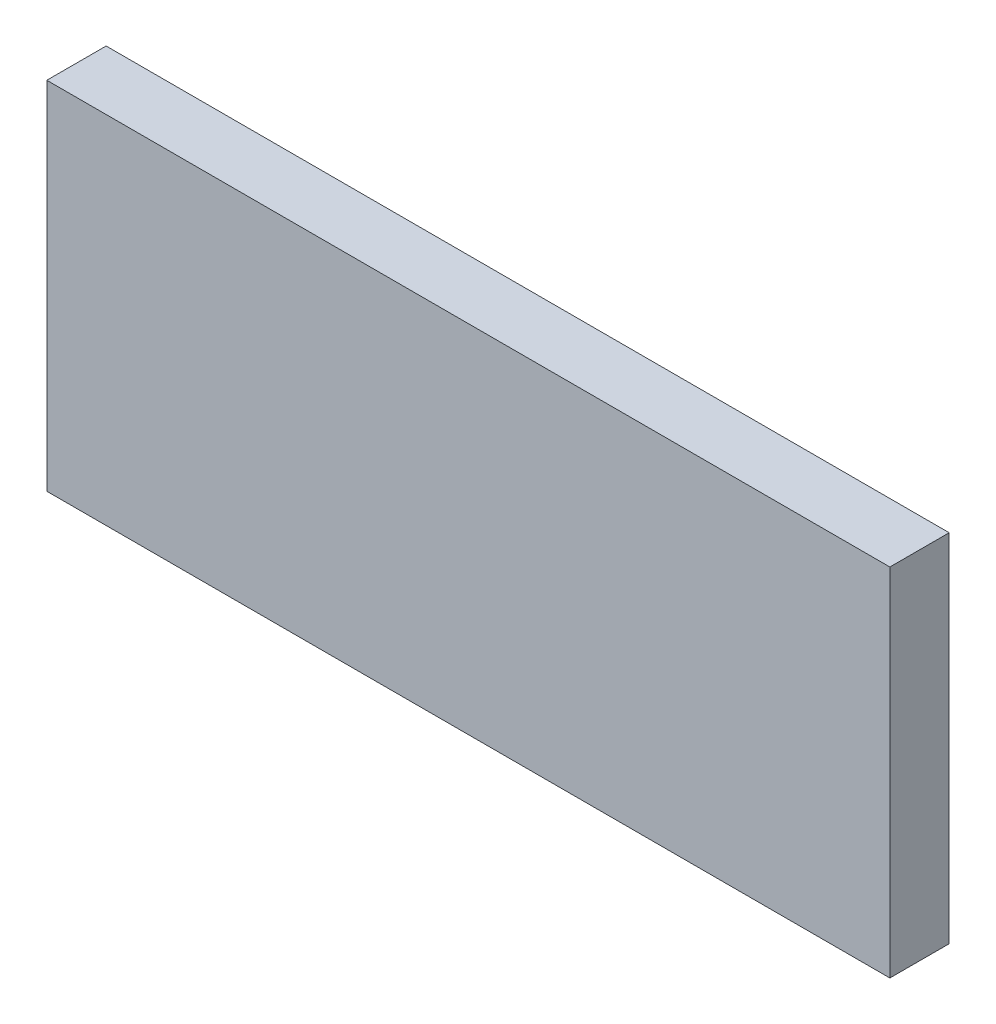
from build123d import *

# Parameters (mm, degrees)
CROQUIS1_W              = 27
CROQUIS1_H              = 11.4
SALIENTE_EXTRUIR1_DEPTH = 1.9


with BuildPart() as part:
    # Croquis1 → Saliente-Extruir1 (new body)
    with BuildSketch(Plane.XY):
        Rectangle(CROQUIS1_W, CROQUIS1_H)
    extrude(amount=SALIENTE_EXTRUIR1_DEPTH)


solid = part.part
